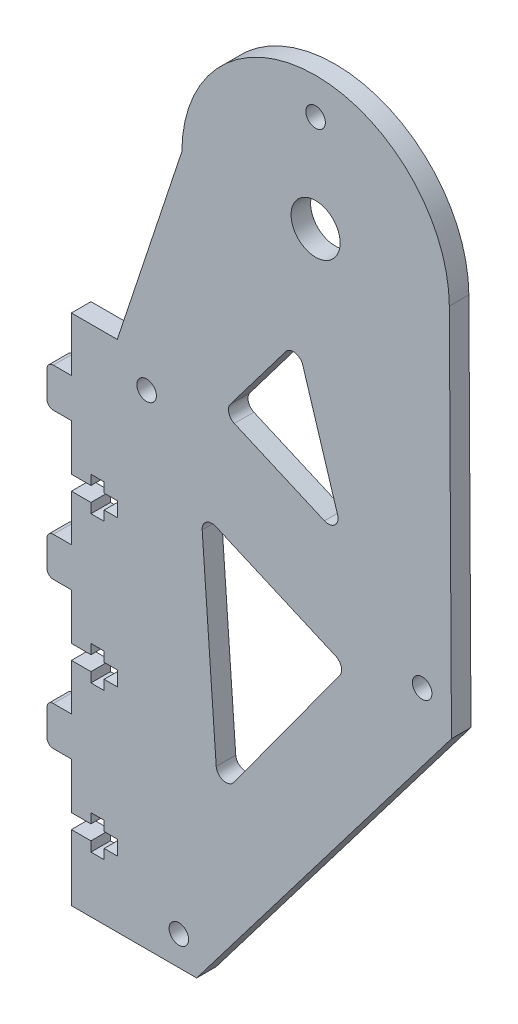
from build123d import *

# Parameters (mm, degrees)
SKETCH_1_R      = 5.0225
SKETCH_1_R_2    = 2
EXTRUDE_1_DEPTH = 4
FILLET_1_R      = 2
FILLET_2_R      = 1.3


with BuildPart() as part:
    # 草图1 → 凸台-拉伸1 (new body)
    with BuildSketch(Plane.XY):
        with BuildLine():
            Line((298.551498293, -96.645689396), (302.551498293, -96.645689396))
            Line((302.551498293, -96.645689396), (302.551498293, -98.644151028))
            Line((302.551498293, -98.644151028), (305.251498293, -98.644151028))
            Line((305.251498293, -98.644151028), (305.251498293, -96.645689396))
            Line((305.251498293, -96.645689396), (307.951498293, -96.645689396))
            Line((307.951498293, -96.645689396), (307.951498293, -93.645689396))
            Line((307.951498293, -93.645689396), (305.251498293, -93.645689396))
            Line((305.251498293, -93.645689396), (305.251498293, -91.647227763))
            Line((305.251498293, -91.647227763), (302.551498293, -91.647227763))
            Line((302.551498293, -91.647227763), (302.551498293, -93.645689396))
            Line((302.551498293, -93.645689396), (298.551498293, -93.645689396))
            Line((298.551498293, -93.645689396), (298.551498293, -84.145716775))
            Line((298.551498293, -84.145716775), (293.551498293, -84.145716775))
            Line((293.551498293, -84.145716775), (293.551498293, -76.145716775))
            Line((293.551498293, -76.145716775), (298.551498293, -76.145716775))
            Line((298.551498293, -76.145716775), (298.551498293, -66.645694374))
            Line((298.551498293, -66.645694374), (302.551498293, -66.645694374))
            Line((302.551498293, -66.645694374), (302.551498293, -68.644156006))
            Line((302.551498293, -68.644156006), (305.251498293, -68.644156006))
            Line((305.251498293, -68.644156006), (305.251498293, -66.645694374))
            Line((305.251498293, -66.645694374), (307.951498293, -66.645694374))
            Line((307.951498293, -66.645694374), (307.951498293, -63.645694374))
            Line((307.951498293, -63.645694374), (305.251498293, -63.645694374))
            Line((305.251498293, -63.645694374), (305.251498293, -61.647232741))
            Line((305.251498293, -61.647232741), (302.551498293, -61.647232741))
            Line((302.551498293, -61.647232741), (302.551498293, -63.645694374))
            Line((302.551498293, -63.645694374), (298.551498293, -63.645694374))
            Line((298.551498293, -63.645694374), (298.551498293, -54.145671973))
            Line((298.551498293, -54.145671973), (293.551498293, -54.145671973))
            Line((293.551498293, -54.145671973), (293.551498293, -46.145671973))
            Line((293.551498293, -46.145671973), (298.551498293, -46.145671973))
            Line((298.551498293, -46.145671973), (298.551498293, -35.045714286))
            Line((298.551498293, -35.045714286), (307.942857143, -35.045714286))
            Line((307.942857143, -35.045714286), (321.159325739, 4.854285714))
            ThreePointArc((321.159325739, 4.854285714), (348.542857143, 32.081451417), (375.926388547, 4.854285714))
            Line((375.926388547, 4.854285714), (376.364473934, -71.645714286))
            Line((376.364473934, -71.645714286), (324.194731876, -140.145734198))
            Line((324.194731876, -140.145734198), (298.551498293, -140.145734198))
            Line((298.551498293, -140.145734198), (298.551498293, -126.645734198))
            Line((298.551498293, -126.645734198), (302.551498293, -126.645734198))
            Line((302.551498293, -126.645734198), (302.551498293, -128.644195831))
            Line((302.551498293, -128.644195831), (305.251498293, -128.644195831))
            Line((305.251498293, -128.644195831), (305.251498293, -126.645734198))
            Line((305.251498293, -126.645734198), (307.951498293, -126.645734198))
            Line((307.951498293, -126.645734198), (307.951498293, -123.645734198))
            Line((307.951498293, -123.645734198), (305.251498293, -123.645734198))
            Line((305.251498293, -123.645734198), (305.251498293, -121.647272565))
            Line((305.251498293, -121.647272565), (302.551498293, -121.647272565))
            Line((302.551498293, -121.647272565), (302.551498293, -123.645734198))
            Line((302.551498293, -123.645734198), (298.551498293, -123.645734198))
            Line((298.551498293, -123.645734198), (298.551498293, -114.145711797))
            Line((298.551498293, -114.145711797), (293.551498293, -114.145711797))
            Line((293.551498293, -114.145711797), (293.551498293, -106.145711797))
            Line((293.551498293, -106.145711797), (298.551498293, -106.145711797))
            Line((298.551498293, -106.145711797), (298.551498293, -96.645689396))
        make_face()
        with Locations((348.542857143, 4.854285714)):
            Circle(SKETCH_1_R, mode=Mode.SUBTRACT)
        with Locations((348.542857143, 24.697471009)):
            Circle(SKETCH_1_R_2, mode=Mode.SUBTRACT)
        with Locations((320.551498293, -134.145734198)):
            Circle(SKETCH_1_R_2, mode=Mode.SUBTRACT)
        with Locations((370.364473934, -65.645714286)):
            Circle(SKETCH_1_R_2, mode=Mode.SUBTRACT)
        with Locations((313.942857143, -41.045714286)):
            Circle(SKETCH_1_R_2, mode=Mode.SUBTRACT)
        Polygon((354.95315454, -69.835495731), (328.585486884, -106.094838527), (325.087312939, -56.813896117), align=None, mode=Mode.SUBTRACT)
        Polygon((329.57699596, -36.9530828), (354.34318526, -47.751218186), (344.764617274, -16.87417598), align=None, mode=Mode.SUBTRACT)
    extrude(amount=EXTRUDE_1_DEPTH)

    # 圆角1
    fillet_1_edges = [part.edges().sort_by_distance(p)[0] for p in [
        (354.95315454, -69.835495731, 2),
        (325.087312939, -56.813896117, 2),
        (328.585486884, -106.094838527, 2),
        (344.764617274, -16.87417598, 2),
        (329.57699596, -36.9530828, 2),
        (354.34318526, -47.751218186, 2),
    ]]
    fillet(fillet_1_edges, radius=FILLET_1_R)

    # 圆角2
    fillet_2_edges = [part.edges().sort_by_distance(p)[0] for p in [
        (293.551498293, -114.145711797, 2),
        (293.551498293, -106.145711797, 2),
        (293.551498293, -84.145716775, 2),
        (293.551498293, -76.145716775, 2),
        (293.551498293, -54.145671973, 2),
        (293.551498293, -46.145671973, 2),
    ]]
    fillet(fillet_2_edges, radius=FILLET_2_R)


solid = part.part
